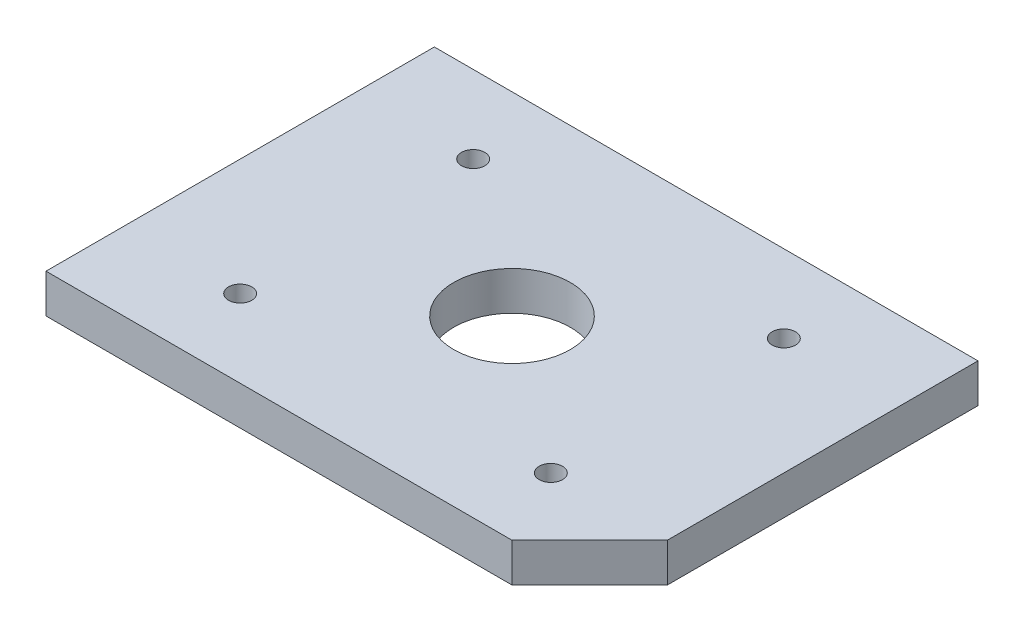
from build123d import *

# Parameters (mm, degrees)
SKETCH1_R           = 1.5
SKETCH1_R_2         = 7.5
BOSS_EXTRUDE1_DEPTH = 5


with BuildPart() as part:
    # Sketch1 → Boss-Extrude1 (new body)
    with BuildSketch(Plane(origin=(0, 0, 0), x_dir=(1, 0, 0), z_dir=(0, 1, 0))):
        Polygon((-35, -25), (25, -25), (35, -15), (35, 25), (-35, 25), align=None)
        with Locations(Location((-20, -15, 0), (0, 0, 270))):
            Circle(SKETCH1_R, mode=Mode.SUBTRACT)
        with Locations(Location((0, 0, 0), (0, 0, 270))):
            Circle(SKETCH1_R_2, mode=Mode.SUBTRACT)
        with Locations(Location((20, -15, 0), (0, 0, 270))):
            Circle(SKETCH1_R, mode=Mode.SUBTRACT)
        with Locations(Location((-20, 15, 0), (0, 0, 270))):
            Circle(SKETCH1_R, mode=Mode.SUBTRACT)
        with Locations(Location((20, 15, 0), (0, 0, 270))):
            Circle(SKETCH1_R, mode=Mode.SUBTRACT)
    extrude(amount=BOSS_EXTRUDE1_DEPTH)


solid = part.part
